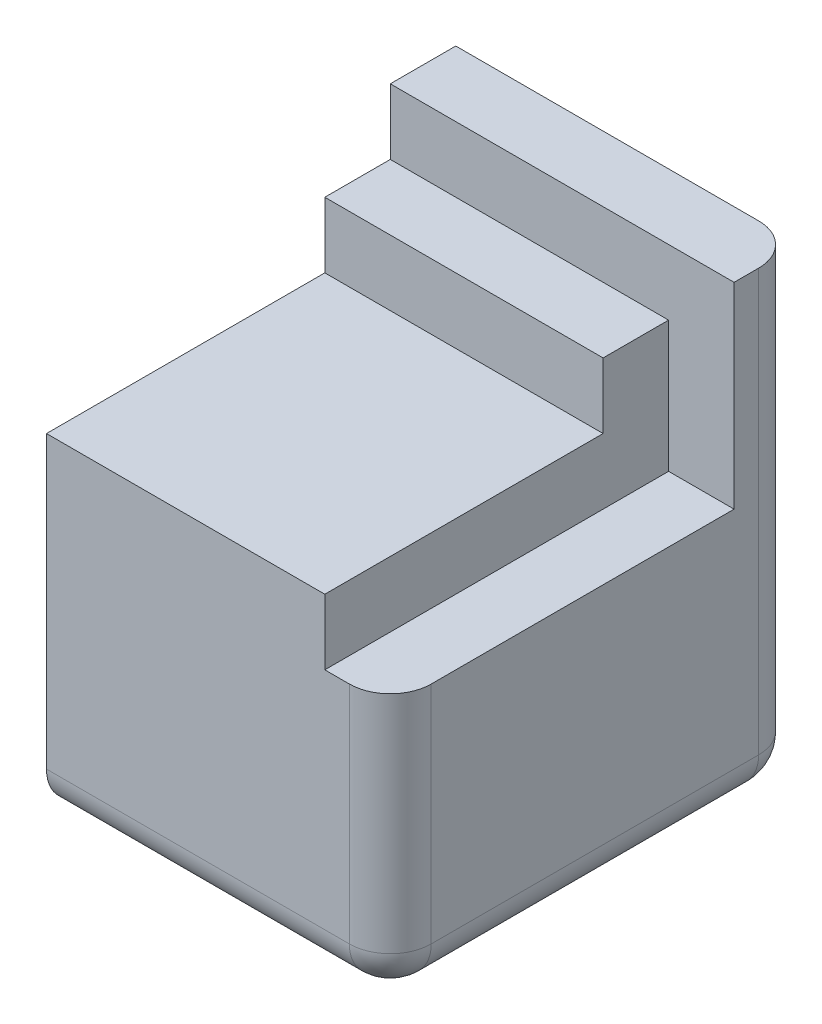
from build123d import *

# Parameters (mm, degrees)
SKETCH1_W                 = 8.4
SKETCH1_H                 = 10
BOSS_EXTRUDE1_DEPTH       = 11.3
SKETCH4_W                 = 8.4
SKETCH4_H                 = 1.6
CUT_EXTRUDE1_DEPTH        = 11.3
SKETCH5_W                 = 8.4
SKETCH5_H                 = 3.2
CUT_EXTRUDE2_DEPTH        = 1.6
SKETCH6_W                 = 8.4
SKETCH6_H                 = 1.6
CUT_EXTRUDE3_DEPTH        = 6.8
SKETCH7_W                 = 6.8
SKETCH7_H                 = 1.6
BOSS_EXTRUDE2_DEPTH       = 1.6
FILLET1_R                 = 1
M3X0_5_TAPPED_HOLE1_D     = 2.5
M3X0_5_TAPPED_HOLE1_DEPTH = 6.5
M3X0_5_TAPPED_HOLE1_TIP   = 0.751075774


with BuildPart() as part:
    # Sketch1 → Boss-Extrude1 (new body)
    with BuildSketch(Plane(origin=(0, 0, 0), x_dir=(1, 0, 0), z_dir=(0, 1, 0))):
        Rectangle(SKETCH1_W, SKETCH1_H)
    extrude(amount=BOSS_EXTRUDE1_DEPTH)

    # Sketch4 → Cut-Extrude1 (cut)
    with BuildSketch(Plane(origin=(4.2, 0, 0), x_dir=(0, 0, -1), z_dir=(1, 0, 0))):
        with Locations((-0.8, 10.5)):
            Rectangle(SKETCH4_W, SKETCH4_H)
    extrude(amount=-CUT_EXTRUDE1_DEPTH, mode=Mode.SUBTRACT)

    # Sketch5 → Cut-Extrude2 (cut)
    with BuildSketch(Plane(origin=(4.2, 0, 0), x_dir=(0, 0, -1), z_dir=(1, 0, 0))):
        with Locations((-0.8, 8.1)):
            Rectangle(SKETCH5_W, SKETCH5_H)
    extrude(amount=-CUT_EXTRUDE2_DEPTH, mode=Mode.SUBTRACT)

    # Sketch6 → Cut-Extrude3 (cut)
    with BuildSketch(Plane(origin=(2.6, 0, 0), x_dir=(0, 0, -1), z_dir=(1, 0, 0))):
        with Locations((-0.8, 8.9)):
            Rectangle(SKETCH6_W, SKETCH6_H)
    extrude(amount=-CUT_EXTRUDE3_DEPTH, mode=Mode.SUBTRACT)

    # Sketch7 → Boss-Extrude2 (add)
    with BuildSketch(Plane.XY.offset(-3.4)):
        with Locations((-0.8, 8.9)):
            Rectangle(SKETCH7_W, SKETCH7_H)
    extrude(amount=BOSS_EXTRUDE2_DEPTH)

    # Fillet1
    fillet1_edges = [part.edges().sort_by_distance(p)[0] for p in [
        (4.2, 3.25, 5),
        (0, 0, 5),
        (0, 0, -5),
        (4.2, 0, 0),
        (4.2, 5.65, -5),
    ]]
    fillet(fillet1_edges, radius=FILLET1_R)

    # M3x0.5 Tapped Hole1
    with Locations(Plane.ZY.offset(4.2)):
        with Locations((0, 5)):
            Hole(M3X0_5_TAPPED_HOLE1_D / 2, depth=M3X0_5_TAPPED_HOLE1_DEPTH)
            with Locations((0, 0, -(M3X0_5_TAPPED_HOLE1_DEPTH + M3X0_5_TAPPED_HOLE1_TIP / 2))):  # 118° drill point
                Cone(0, M3X0_5_TAPPED_HOLE1_D / 2, M3X0_5_TAPPED_HOLE1_TIP, mode=Mode.SUBTRACT)


solid = part.part
